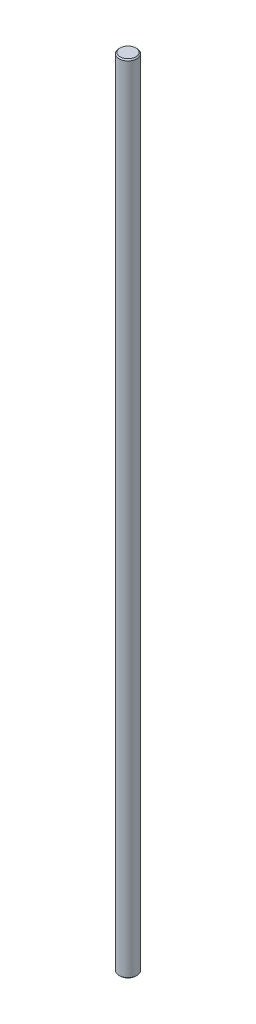
from build123d import *

# Parameters (mm, degrees)
SKETCH1_R           = 4
BOSS_EXTRUDE1_DEPTH = 357
CHAMFER1_SIZE       = 0.5


with BuildPart() as part:
    # Sketch1 → Boss-Extrude1 (new body)
    with BuildSketch(Plane(origin=(0, 0, 0), x_dir=(1, 0, 0), z_dir=(0, 1, 0))):
        with Locations(Location((0, 0, 0), (0, 0, 270))):
            Circle(SKETCH1_R)
    extrude(amount=BOSS_EXTRUDE1_DEPTH)

    # Chamfer1
    chamfer1_edges = [part.edges().sort_by_distance(p)[0] for p in [
        (0, 0, -4),
        (0, 357, -4),
    ]]
    chamfer(chamfer1_edges, length=CHAMFER1_SIZE)


solid = part.part
